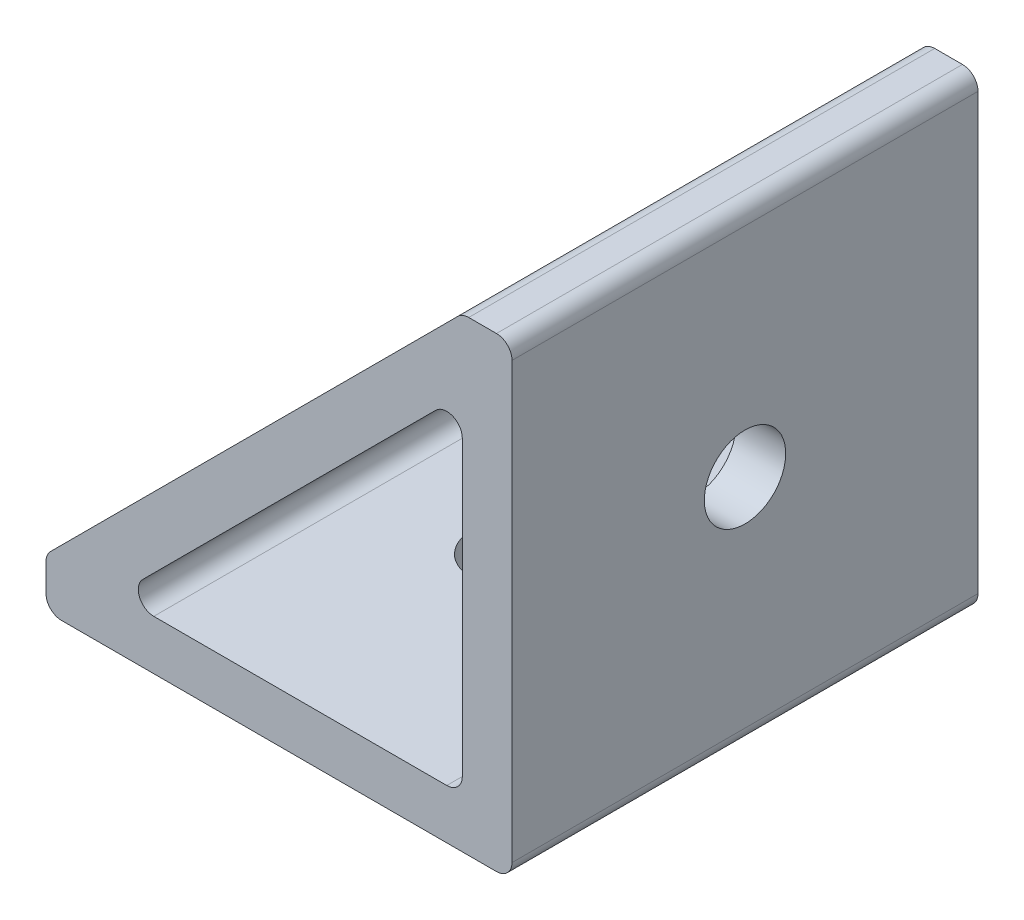
from build123d import *

# Parameters (mm, degrees)
BOSS_EXTRUDE1_DEPTH = 19.05
CUT_EXTRUDE2_REACH  = 59.15
SKETCH3_R           = 3.3274
CUT_EXTRUDE3_REACH  = 59.15
SKETCH4_R           = 3.3274
CUT_EXTRUDE1_REACH  = 37.381
FILLET1_R           = 1.27


with BuildPart() as part:
    # Sketch1 → Boss-Extrude1 (new, symmetric)
    with BuildSketch(Plane.XY):
        Polygon((0, 0), (0, 38.1), (-4.064, 38.1), (-38.1, 4.064), (-38.1, 0), align=None)
        Polygon((-32.352636083, 4.064), (-4.064, 4.064), (-4.064, 32.352636083), align=None, mode=Mode.SUBTRACT)
    extrude(amount=BOSS_EXTRUDE1_DEPTH, both=True)

    # Sketch3 → Cut-Extrude2 (cut, up to next)
    with BuildSketch(Plane(origin=(0, 0, 0), x_dir=(0, 0, -1), z_dir=(1, 0, 0)), mode=Mode.PRIVATE) as cut_extrude2_sk1:
        with Locations(Location((0, 19.05, 0), (0, 0, 90))):
            Circle(SKETCH3_R)
    cut_extrude2_tool1 = extrude(cut_extrude2_sk1.sketch, amount=-CUT_EXTRUDE2_REACH, mode=Mode.PRIVATE) & part.part
    add(cut_extrude2_tool1.solids().sort_by_distance((0, 19.05, 0))[0], mode=Mode.SUBTRACT)

    # Sketch4 → Cut-Extrude3 (cut, up to next)
    with BuildSketch(Plane.XZ, mode=Mode.PRIVATE) as cut_extrude3_sk1:
        with Locations(Location((-19.05, 0, 0), (0, 0, 270))):
            Circle(SKETCH4_R)
    cut_extrude3_tool1 = extrude(cut_extrude3_sk1.sketch, amount=-CUT_EXTRUDE3_REACH, mode=Mode.PRIVATE) & part.part
    add(cut_extrude3_tool1.solids().sort_by_distance((-19.05, 0, 0))[0], mode=Mode.SUBTRACT)

    # Sketch2 → Cut-Extrude1 (cut, up to next)
    with BuildSketch(Plane(origin=(-21.082, 21.082, 0), x_dir=(0, 0, 1), z_dir=(-0.7071067811865477, 0.7071067811865475, 0)), mode=Mode.PRIVATE) as cut_extrude1_sk1:
        with BuildLine():
            Line((3.81, 16.447086404), (-3.81, 16.447086404))
            ThreePointArc((-3.81, 16.447086404), (-9.198153673, 14.215240077), (-11.43, 8.827086404))
            Line((-11.43, 8.827086404), (-11.43, -8.827086404))
            ThreePointArc((-11.43, -8.827086404), (-9.198153673, -14.215240077), (-3.81, -16.447086404))
            Line((-3.81, -16.447086404), (3.81, -16.447086404))
            ThreePointArc((3.81, -16.447086404), (9.198153673, -14.215240077), (11.43, -8.827086404))
            Line((11.43, -8.827086404), (11.43, 8.827086404))
            ThreePointArc((11.43, 8.827086404), (9.198153673, 14.215240077), (3.81, 16.447086404))
        make_face()
    cut_extrude1_tool1 = extrude(cut_extrude1_sk1.sketch, amount=-CUT_EXTRUDE1_REACH, mode=Mode.PRIVATE) & part.part
    add(cut_extrude1_tool1.solids().sort_by_distance((-21.082, 21.082, 0))[0], mode=Mode.SUBTRACT)

    # Fillet1
    fillet1_edges = [part.edges().sort_by_distance(p)[0] for p in [
        (-4.064, 4.064, 0),
        (-4.064, 32.352636083, 0),
        (-32.352636083, 4.064, 0),
        (-38.1, 0, 0),
        (-38.1, 4.064, 0),
        (-4.064, 38.1, 0),
        (0, 38.1, 0),
        (0, 0, 0),
    ]]
    fillet(fillet1_edges, radius=FILLET1_R)


solid = part.part
